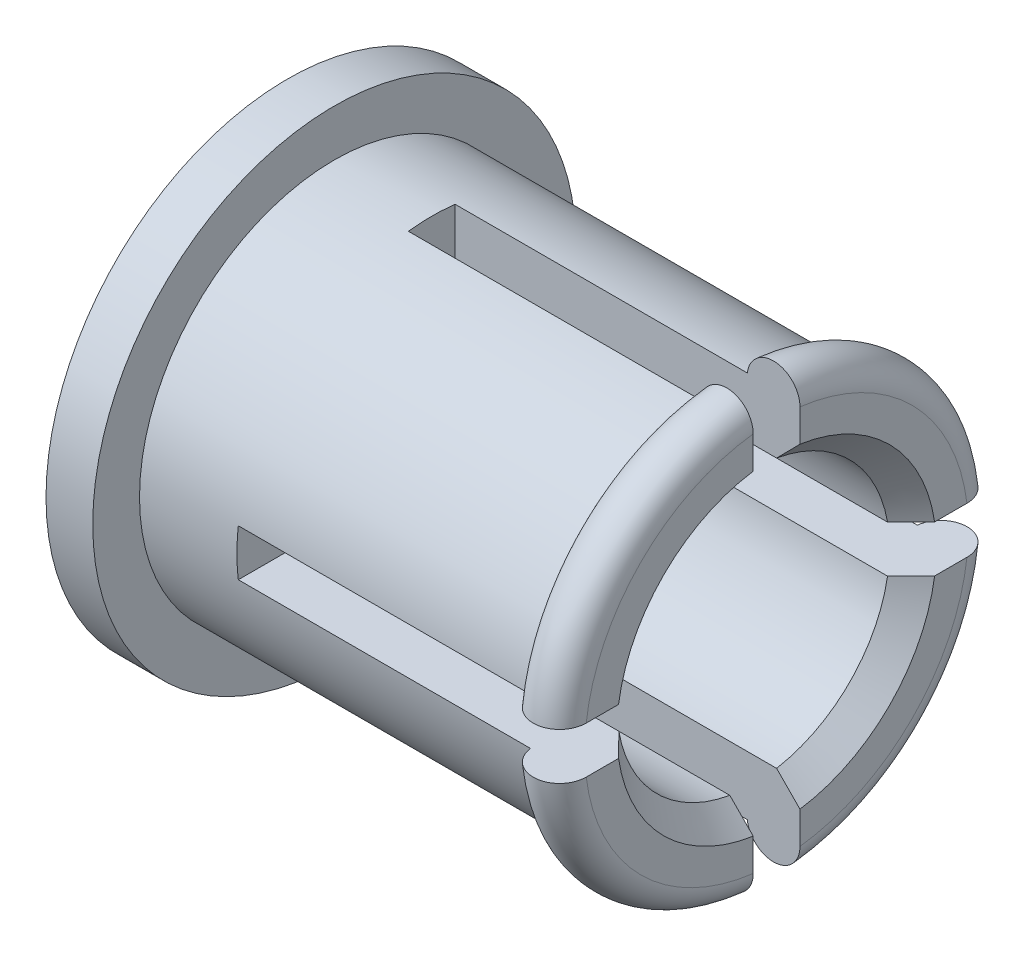
from build123d import *

# Parameters (mm, degrees)
SKETCH2_R          = 4.445
CUT_EXTRUDE1_DEPTH = 18.034
CHAMFER1_SIZE      = 0.762
SKETCH5_W          = 11.240575932
SKETCH5_H          = 1.524
CUT_EXTRUDE2_DEPTH = 20.444017921
CIRPATTERN1_COUNT  = 4


with BuildPart() as part:
    # Sketch1 → Revolve1 (revolve)
    with BuildSketch(Plane.XY, mode=Mode.PRIVATE) as revolve1_sk:
        with BuildLine():
            Line((0, 0), (15.939575932, 0))
            Line((15.939575932, 0), (15.939575932, 6.251377289))
            ThreePointArc((15.939575932, 6.251377289), (15.12834599, 7.110581459), (14.224, 6.35))
            Line((14.224, 6.35), (1.524, 6.35))
            Line((1.524, 6.35), (1.524, 7.874))
            Line((1.524, 7.874), (0, 7.874))
            Line((0, 7.874), (0, 0))
        make_face()
    revolve(revolve1_sk.sketch.rotate(Axis((0, 0, 0), (1, 0, 0)), 90), axis=Axis((0, 0, 0), (1, 0, 0)))

    # Sketch2 → Cut-Extrude1 (cut)
    with BuildSketch(Plane.ZY):
        Circle(SKETCH2_R)
    extrude(amount=-CUT_EXTRUDE1_DEPTH, mode=Mode.SUBTRACT)

    # Chamfer1
    chamfer1_edges = [part.edges().sort_by_distance(p)[0] for p in [
        (15.939575932, 0, -4.445),
        (0, 0, -4.445),
    ]]
    chamfer(chamfer1_edges, length=CHAMFER1_SIZE)

    # Sketch5 → Cut-Extrude2 (cut, through all)
    with BuildSketch(Plane.XY):
        with Locations((10.319287966, 0)):
            Rectangle(SKETCH5_W, SKETCH5_H)
    cut_extrude2 = extrude(amount=-CUT_EXTRUDE2_DEPTH, mode=Mode.SUBTRACT)

    # CirPattern1: Cut-Extrude2 ×4 about axis
    cirpattern1_axis = Axis((0, 0, 0), (1, 0, 0))
    for i in range(1, CIRPATTERN1_COUNT):
        add(cut_extrude2.rotate(cirpattern1_axis, i * 360 / CIRPATTERN1_COUNT), mode=Mode.SUBTRACT)


solid = part.part
